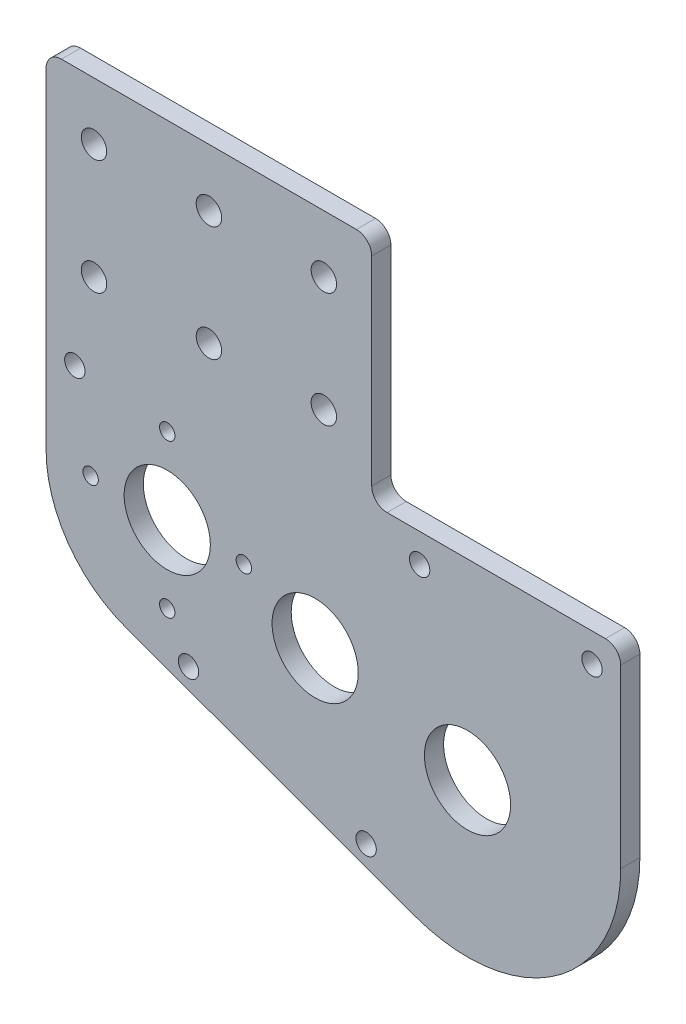
from build123d import *

# Parameters (mm, degrees)
BOSS_EXTRUDE1_DEPTH     = 6.35
SKETCH3_W               = 107.95
SKETCH3_H               = 76.2
BOSS_EXTRUDE2_DEPTH     = 6.35
FILLET1_R               = 5.08
CUT_EXTRUDE1_REACH      = 199.668
SKETCH4_R               = 14.2875
F_10_CLEARANCE_HOLE1_D  = 5.1054
F_1_4_CLEARANCE_HOLE1_D = 6.7564
SKETCH12_R              = 4.2164
CUT_EXTRUDE2_DEPTH      = 6.35


with BuildPart() as part:
    # Sketch2 → Boss-Extrude1 (new body)
    with BuildSketch(Plane.XY):
        with BuildLine():
            Line((50.8, 63.5), (-139.7, 63.5))
            Line((-139.7, 63.5), (-139.7, 24.9428))
            ThreePointArc((-139.7, 24.9428), (-132.440569937, 1.912367752), (-113.286645893, -12.792302529))
            Line((-113.286645893, -12.792302529), (-17.389986907, -47.730790433))
            ThreePointArc((-17.389986907, -47.730790433), (29.130985781, -41.617612467), (50.8, 0))
            Line((50.8, 0), (50.8, 63.5))
        make_face()
    extrude(amount=-BOSS_EXTRUDE1_DEPTH)

    # Sketch3 → Boss-Extrude2 (add)
    with BuildSketch(Plane.XY):
        with Locations((-85.725, 101.6)):
            Rectangle(SKETCH3_W, SKETCH3_H)
    extrude(amount=-BOSS_EXTRUDE2_DEPTH)

    # Fillet1
    fillet1_edges = [part.edges().sort_by_distance(p)[0] for p in [
        (50.8, 63.5, -3.175),
        (-31.75, 139.7, -3.175),
        (-139.7, 139.7, -3.175),
        (-31.75, 63.5, -3.175),
    ]]
    fillet(fillet1_edges, radius=FILLET1_R)

    # Sketch4 → Cut-Extrude1 (cut, up to next)
    with BuildSketch(Plane.XY, mode=Mode.PRIVATE) as cut_extrude1_sk1:
        Circle(SKETCH4_R)
    cut_extrude1_tool1 = extrude(cut_extrude1_sk1.sketch, amount=-CUT_EXTRUDE1_REACH, mode=Mode.PRIVATE) & part.part
    # Sketch4 → Cut-Extrude1 (cut, up to next)
    with BuildSketch(Plane.XY, mode=Mode.PRIVATE) as cut_extrude1_sk2:
        with Locations((-50.508364656, 12.656618812)):
            Circle(SKETCH4_R)
    cut_extrude1_tool2 = extrude(cut_extrude1_sk2.sketch, amount=-CUT_EXTRUDE1_REACH, mode=Mode.PRIVATE) & part.part
    # Sketch4 → Cut-Extrude1 (cut, up to next)
    with BuildSketch(Plane.XY, mode=Mode.PRIVATE) as cut_extrude1_sk3:
        with Locations((-99.538435713, 24.9428)):
            Circle(SKETCH4_R)
    cut_extrude1_tool3 = extrude(cut_extrude1_sk3.sketch, amount=-CUT_EXTRUDE1_REACH, mode=Mode.PRIVATE) & part.part
    add(cut_extrude1_tool1.solids().sort_by_distance((0, 0, 0))[0], mode=Mode.SUBTRACT)
    add(cut_extrude1_tool2.solids().sort_by_distance((-50.508365, 12.656619, 0))[0], mode=Mode.SUBTRACT)
    add(cut_extrude1_tool3.solids().sort_by_distance((-99.538436, 24.9428, 0))[0], mode=Mode.SUBTRACT)

    # #10 Clearance Hole1 (through all)
    with Locations(Plane.XY):
        with Locations((-99.538435713, -0.4572), (-124.938435713, 24.9428), (-99.538435713, 50.3428), (-74.138435713, 24.9428)):
            Hole(F_10_CLEARANCE_HOLE1_D / 2)

    # 1/4 Clearance Hole1 (through all)
    with Locations(Plane.XY):
        with Locations((-33.612632623, -35.061995487), (-92.482563874, -13.613632189), (-130.175, 53.975), (-15.875, 53.975), (41.275, 53.975)):
            Hole(F_1_4_CLEARANCE_HOLE1_D / 2)

    # Sketch12 → Cut-Extrude2 (cut)
    with BuildSketch(Plane.XY):
        with Locations((-123.825, 120.65)):
            Circle(SKETCH12_R)
        with Locations((-123.825, 82.55)):
            Circle(SKETCH12_R)
        with Locations((-85.725, 120.65)):
            Circle(SKETCH12_R)
        with Locations((-85.725, 82.55)):
            Circle(SKETCH12_R)
        with Locations((-47.625, 82.55)):
            Circle(SKETCH12_R)
        with Locations((-47.625, 120.65)):
            Circle(SKETCH12_R)
    extrude(amount=-CUT_EXTRUDE2_DEPTH, mode=Mode.SUBTRACT)


solid = part.part
